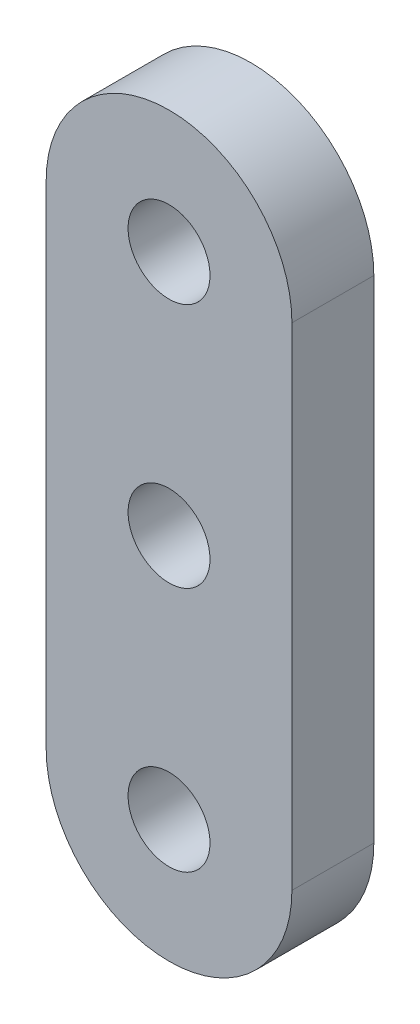
from build123d import *

# Parameters (mm, degrees)
MODEL_R                 = 1.5
SALIENTE_EXTRUIR1_DEPTH = 3


with BuildPart() as part:
    # Model → Saliente-Extruir1 (new body)
    with BuildSketch(Plane.XY):
        with BuildLine():
            Line((213.25077615, 152.428489513), (213.25077615, 170.428489513))
            ThreePointArc((213.25077615, 170.428489513), (208.75077615, 174.928489513), (204.25077615, 170.428489513))
            Line((204.25077615, 170.428489513), (204.25077615, 152.428489513))
            ThreePointArc((204.25077615, 152.428489513), (208.75077615, 147.928489513), (213.25077615, 152.428489513))
        make_face()
        with Locations((208.75077615, 152.428489513)):
            Circle(MODEL_R, mode=Mode.SUBTRACT)
        with Locations((208.75077615, 161.428489513)):
            Circle(MODEL_R, mode=Mode.SUBTRACT)
        with Locations((208.75077615, 170.428489513)):
            Circle(MODEL_R, mode=Mode.SUBTRACT)
    extrude(amount=SALIENTE_EXTRUIR1_DEPTH)


solid = part.part
